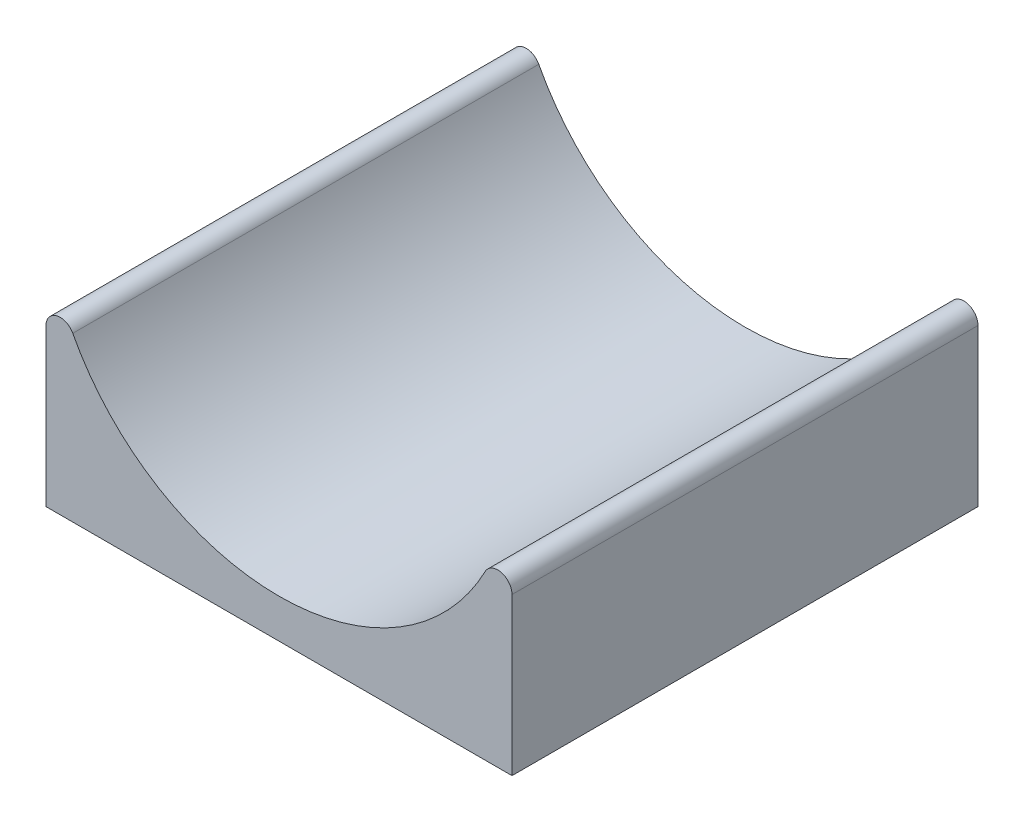
from build123d import *

# Parameters (mm, degrees)
BOSS_EXTRUDE1_DEPTH = 41.656


with BuildPart() as part:
    # Sketch1 → Boss-Extrude1 (new body)
    with BuildSketch(Plane.XY):
        with BuildLine():
            Line((-20.828, -10.28621602), (-20.828, -24.308623206))
            Line((-20.828, -24.308623206), (20.828, -24.308623206))
            Line((20.828, -24.308623206), (20.828, -10.28621602))
            ThreePointArc((20.828, -10.28621602), (19.862459196, -9.053250246), (18.433977011, -9.695054179))
            ThreePointArc((18.433977011, -9.695054179), (0, -20.828), (-18.433977011, -9.695054179))
            ThreePointArc((-18.433977011, -9.695054179), (-19.862459196, -9.053250246), (-20.828, -10.28621602))
        make_face()
    extrude(amount=BOSS_EXTRUDE1_DEPTH)


solid = part.part
